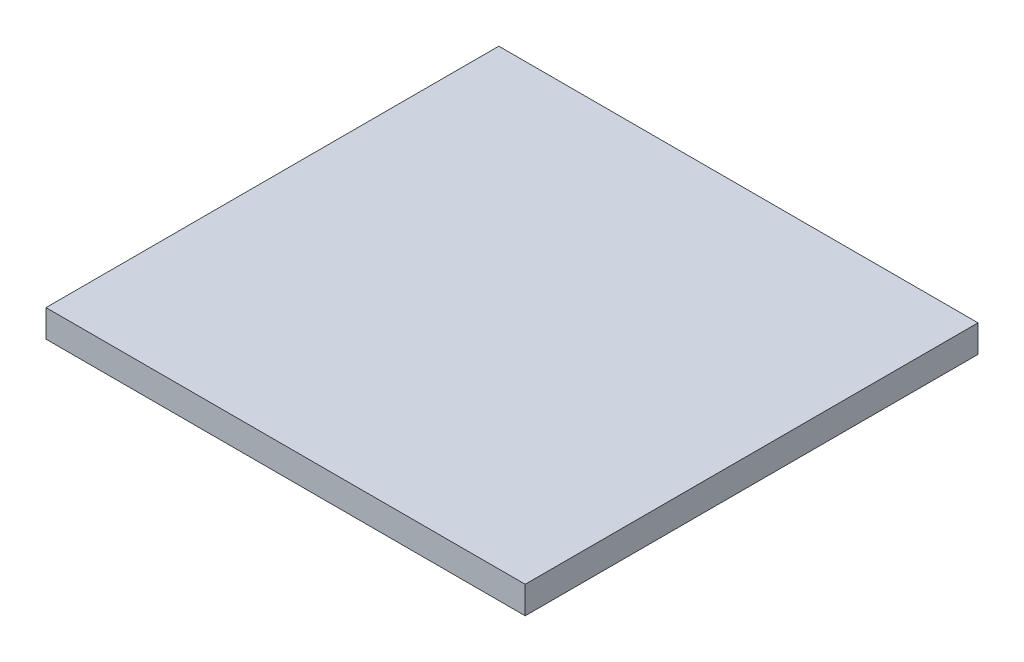
from build123d import *

# Parameters (mm, degrees)
SKETCH1_W           = 208.332578
SKETCH1_H           = 196.85
BOSS_EXTRUDE1_DEPTH = 11.8872


with BuildPart() as part:
    # Sketch1 → Boss-Extrude1 (new body)
    with BuildSketch(Plane(origin=(0, 0, 0), x_dir=(1, 0, 0), z_dir=(0, 1, 0))):
        Rectangle(SKETCH1_W, SKETCH1_H)
    extrude(amount=BOSS_EXTRUDE1_DEPTH)


solid = part.part
